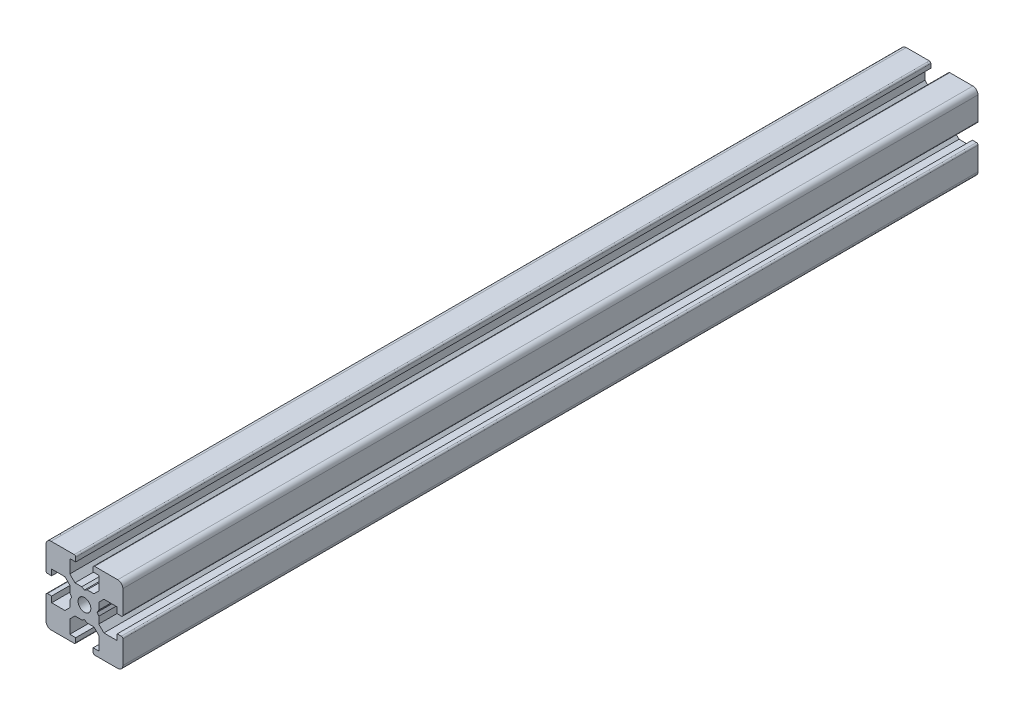
from build123d import *

# Parameters (mm, degrees)
SKETCH1_R           = 1.25
BOSS_EXTRUDE1_DEPTH = 166.878


with BuildPart() as part:
    # Sketch1 → Boss-Extrude1 (new body)
    with BuildSketch(Plane.XY.offset(300)):
        with BuildLine():
            Line((-7.5, 6.5), (-7.5, 2))
            ThreePointArc((-7.5, 2), (-7.412132034, 1.787867966), (-7.2, 1.7))
            Line((-7.2, 1.7), (-6.4, 1.7))
            Line((-6.4, 1.7), (-6.4, 2.85))
            Line((-6.4, 2.85), (-3.8, 2.85))
            Line((-3.8, 2.85), (-2.8, 1.85))
            Line((-2.8, 1.85), (-2.8, 0.519615242))
            Line((-2.8, 0.519615242), (-2.5, 0))
            Line((-2.5, 0), (-2.8, -0.519615242))
            Line((-2.8, -0.519615242), (-2.8, -1.85))
            Line((-2.8, -1.85), (-3.8, -2.85))
            Line((-3.8, -2.85), (-6.4, -2.85))
            Line((-6.4, -2.85), (-6.4, -1.7))
            Line((-6.4, -1.7), (-7.2, -1.7))
            ThreePointArc((-7.2, -1.7), (-7.412132034, -1.787867966), (-7.5, -2))
            Line((-7.5, -2), (-7.5, -6.5))
            ThreePointArc((-7.5, -6.5), (-7.207106781, -7.207106781), (-6.5, -7.5))
            Line((-6.5, -7.5), (-2, -7.5))
            ThreePointArc((-2, -7.5), (-1.787867966, -7.412132034), (-1.7, -7.2))
            Line((-1.7, -7.2), (-1.7, -6.4))
            Line((-1.7, -6.4), (-2.85, -6.4))
            Line((-2.85, -6.4), (-2.85, -3.8))
            Line((-2.85, -3.8), (-1.85, -2.8))
            Line((-1.85, -2.8), (-0.519615242, -2.8))
            Line((-0.519615242, -2.8), (0, -2.5))
            Line((0, -2.5), (0.519615242, -2.8))
            Line((0.519615242, -2.8), (1.85, -2.8))
            Line((1.85, -2.8), (2.85, -3.8))
            Line((2.85, -3.8), (2.85, -6.4))
            Line((2.85, -6.4), (1.7, -6.4))
            Line((1.7, -6.4), (1.7, -7.2))
            ThreePointArc((1.7, -7.2), (1.787867966, -7.412132034), (2, -7.5))
            Line((2, -7.5), (6.5, -7.5))
            ThreePointArc((6.5, -7.5), (7.207106781, -7.207106781), (7.5, -6.5))
            Line((7.5, -6.5), (7.5, -2))
            ThreePointArc((7.5, -2), (7.412132034, -1.787867966), (7.2, -1.7))
            Line((7.2, -1.7), (6.4, -1.7))
            Line((6.4, -1.7), (6.4, -2.85))
            Line((6.4, -2.85), (3.8, -2.85))
            Line((3.8, -2.85), (2.8, -1.85))
            Line((2.8, -1.85), (2.8, -0.519615242))
            Line((2.8, -0.519615242), (2.5, 0))
            Line((2.5, 0), (2.8, 0.519615242))
            Line((2.8, 0.519615242), (2.8, 1.85))
            Line((2.8, 1.85), (3.8, 2.85))
            Line((3.8, 2.85), (6.4, 2.85))
            Line((6.4, 2.85), (6.4, 1.7))
            Line((6.4, 1.7), (7.2, 1.7))
            ThreePointArc((7.2, 1.7), (7.412132034, 1.787867966), (7.5, 2))
            Line((7.5, 2), (7.5, 6.5))
            ThreePointArc((7.5, 6.5), (7.207106781, 7.207106781), (6.5, 7.5))
            Line((6.5, 7.5), (2, 7.5))
            ThreePointArc((2, 7.5), (1.787867966, 7.412132034), (1.7, 7.2))
            Line((1.7, 7.2), (1.7, 6.4))
            Line((1.7, 6.4), (2.85, 6.4))
            Line((2.85, 6.4), (2.85, 3.8))
            Line((2.85, 3.8), (1.85, 2.8))
            Line((1.85, 2.8), (0.519615242, 2.8))
            Line((0.519615242, 2.8), (0, 2.5))
            Line((0, 2.5), (-0.519615242, 2.8))
            Line((-0.519615242, 2.8), (-1.85, 2.8))
            Line((-1.85, 2.8), (-2.85, 3.8))
            Line((-2.85, 3.8), (-2.85, 6.4))
            Line((-2.85, 6.4), (-1.7, 6.4))
            Line((-1.7, 6.4), (-1.7, 7.2))
            ThreePointArc((-1.7, 7.2), (-1.787867966, 7.412132034), (-2, 7.5))
            Line((-2, 7.5), (-6.5, 7.5))
            ThreePointArc((-6.5, 7.5), (-7.207106781, 7.207106781), (-7.5, 6.5))
        make_face()
        with Locations(Location((0, 0, 0), (0, 0, 180))):
            Circle(SKETCH1_R, mode=Mode.SUBTRACT)
    extrude(amount=-BOSS_EXTRUDE1_DEPTH)


solid = part.part
